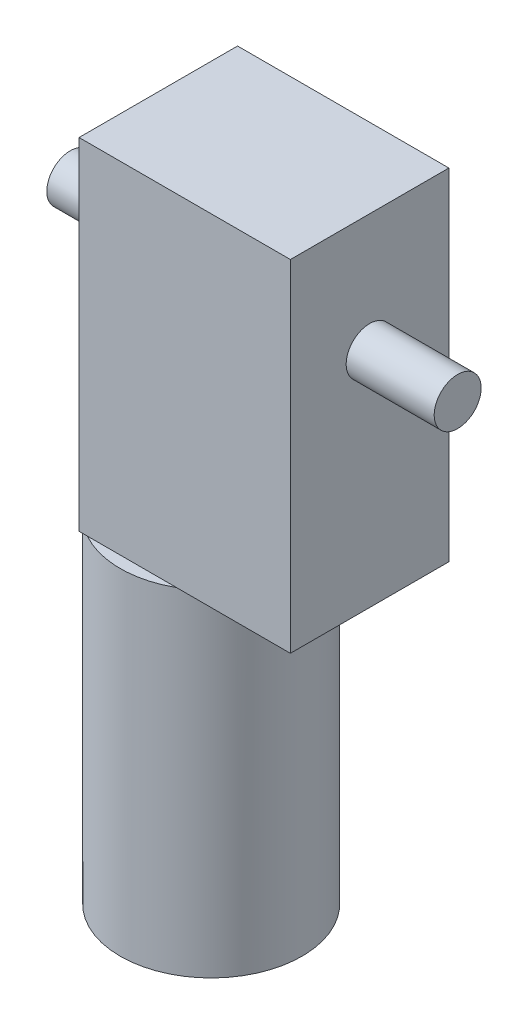
from build123d import *

# Parameters (mm, degrees)
SKETCH2_R                = 15.494
BOSS_EXTRUDE1_DEPTH      = 57.2
SKETCH3_W                = 36
SKETCH3_H                = 27
BOSS_EXTRUDE2_DEPTH      = 58.1
BOSS_EXTRUDE3_DEPTH      = 15
BOSS_EXTRUDE3_DEPTH_BACK = 51
SKETCH4_R                = 4


with BuildPart() as part:
    # Sketch2 → Boss-Extrude1 (new body)
    with BuildSketch(Plane(origin=(0, 0, 0), x_dir=(1, 0, 0), z_dir=(0, 1, 0))):
        with Locations(Location((0, 0, 0), (0, 0, 270))):
            Circle(SKETCH2_R)
    extrude(amount=BOSS_EXTRUDE1_DEPTH)

    # Sketch3 → Boss-Extrude2 (add)
    with BuildSketch(Plane(origin=(0, 57.2, 0), x_dir=(1, 0, 0), z_dir=(0, 1, 0))):
        with Locations((9, 0)):
            Rectangle(SKETCH3_W, SKETCH3_H)
    extrude(amount=BOSS_EXTRUDE2_DEPTH)

    # Sketch4 → Boss-Extrude3 (add, two sides: drawn at the far end of the back side and taken through both)
    with BuildSketch(Plane(origin=(27, 0, 0), x_dir=(0, 0, -1), z_dir=(1, 0, 0)).offset(-BOSS_EXTRUDE3_DEPTH_BACK)):
        with Locations((0, 95.1)):
            Circle(SKETCH4_R)
    extrude(amount=BOSS_EXTRUDE3_DEPTH + BOSS_EXTRUDE3_DEPTH_BACK)


solid = part.part
